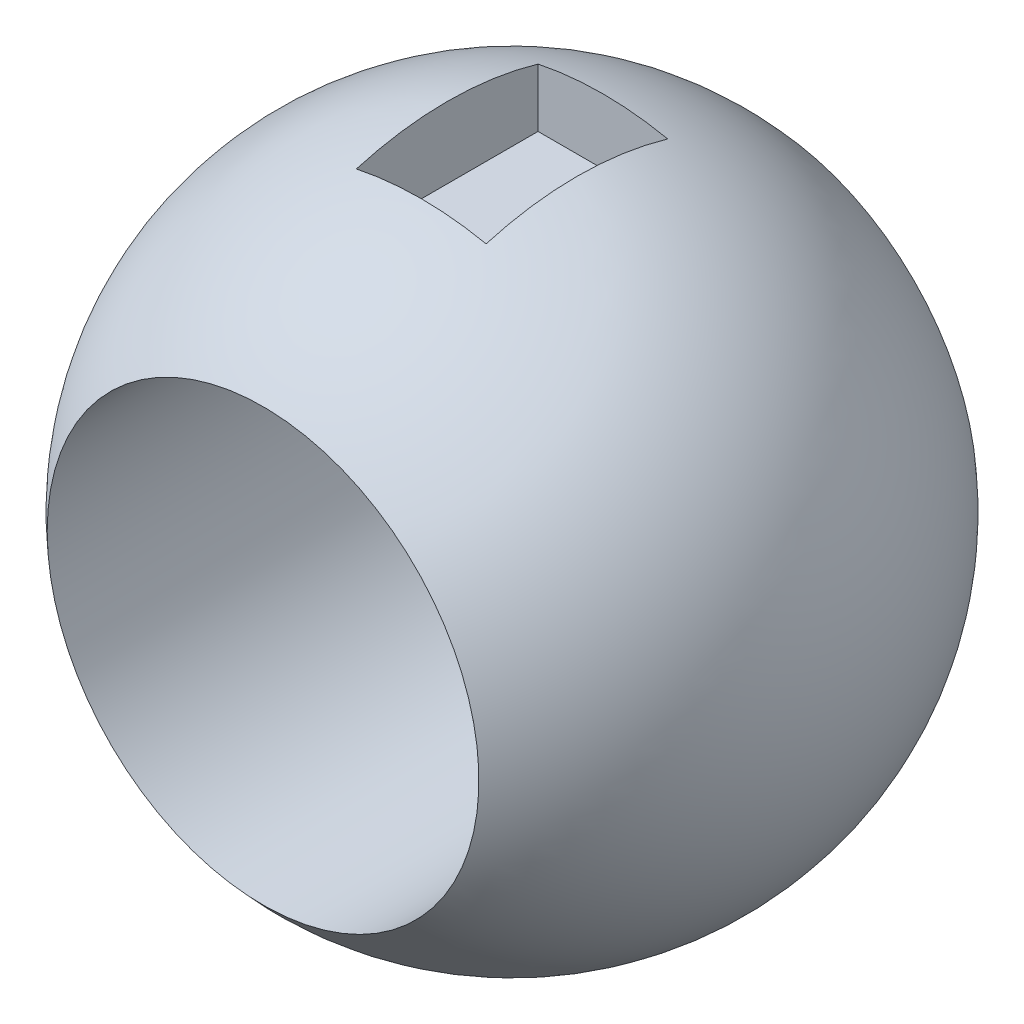
from build123d import *

# Parameters (mm, degrees)
SKETCH5_R          = 16.637
CUT_EXTRUDE2_DEPTH = 58.401742134
SKETCH6_W          = 10
SKETCH6_H          = 14
CUT_EXTRUDE3_DEPTH = 6


with BuildPart() as part:
    # Sketch4 → Revolve4 (revolve)
    with BuildSketch(Plane(origin=(0, 0, 0), x_dir=(1, 0, 0), z_dir=(0, 1, 0))):
        with BuildLine():
            Line((-12, 22.386603137), (0, 22.386603137))
            Line((0, 22.386603137), (0, -22.386603137))
            Line((0, -22.386603137), (-12, -22.386603137))
            ThreePointArc((-12, -22.386603137), (-25.4, 0), (-12, 22.386603137))
        make_face()
    revolve(axis=Axis((0, 0, -17.487077089), (0, 0, 1)))

    # Sketch5 → Cut-Extrude2 (cut, through all)
    with BuildSketch(Plane.XY.offset(22.386603137)):
        with Locations(Location((0, 0, 0), (0, 0, 180))):
            Circle(SKETCH5_R)
    extrude(amount=-CUT_EXTRUDE2_DEPTH, mode=Mode.SUBTRACT)

    # Sketch6 → Cut-Extrude3 (cut)
    with BuildSketch(Plane(origin=(0, 25.4, 0), x_dir=(1, 0, 0), z_dir=(0, 1, 0))):
        Rectangle(SKETCH6_W, SKETCH6_H)
    extrude(amount=-CUT_EXTRUDE3_DEPTH, mode=Mode.SUBTRACT)


solid = part.part
